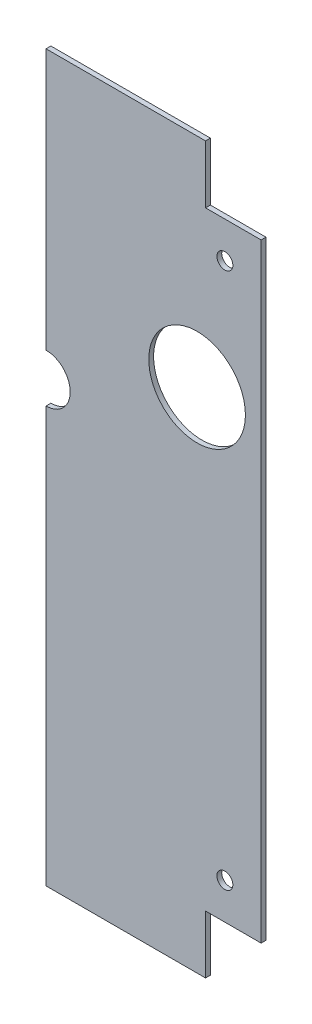
from build123d import *

# Parameters (mm, degrees)
AUFSATZ_LINEAR_AUSTRAGEN1_DEPTH = 2
SKIZZE2_R                       = 20
SKIZZE2_R_2                     = 10
SCHNITT_LINEAR_AUSTRAGEN1_DEPTH = 10
DURCHGANGSLOCH_F_R_M61_D        = 6.6


with BuildPart() as part:
    # Skizze1 → Aufsatz-Linear austragen1 (new body)
    with BuildSketch(Plane.XY):
        Polygon((-4.0015, -24.009838693), (-27.0015, -24.009838693), (-27.0015, -0.009838693), (-93.0015, -0.009838693), (-93.0015, -300.009838693), (-27.0015, -300.009838693), (-27.0015, -276.009838693), (-4.0015, -276.009838693), align=None)
    extrude(amount=AUFSATZ_LINEAR_AUSTRAGEN1_DEPTH)

    # Skizze2 → Schnitt-Linear austragen1 (cut)
    with BuildSketch(Plane.XY.offset(2)):
        with Locations((-30.5, -90.009838693)):
            Circle(SKIZZE2_R)
        with Locations((-93.0015, -118.009838693)):
            Circle(SKIZZE2_R_2)
    extrude(amount=-SCHNITT_LINEAR_AUSTRAGEN1_DEPTH, mode=Mode.SUBTRACT)

    # Durchgangsloch für M61 (through all)
    with Locations(Plane.XY.offset(2)):
        with Locations((-19.0015, -39.009838693), (-19.0015, -261.009838693)):
            Hole(DURCHGANGSLOCH_F_R_M61_D / 2)


solid = part.part
